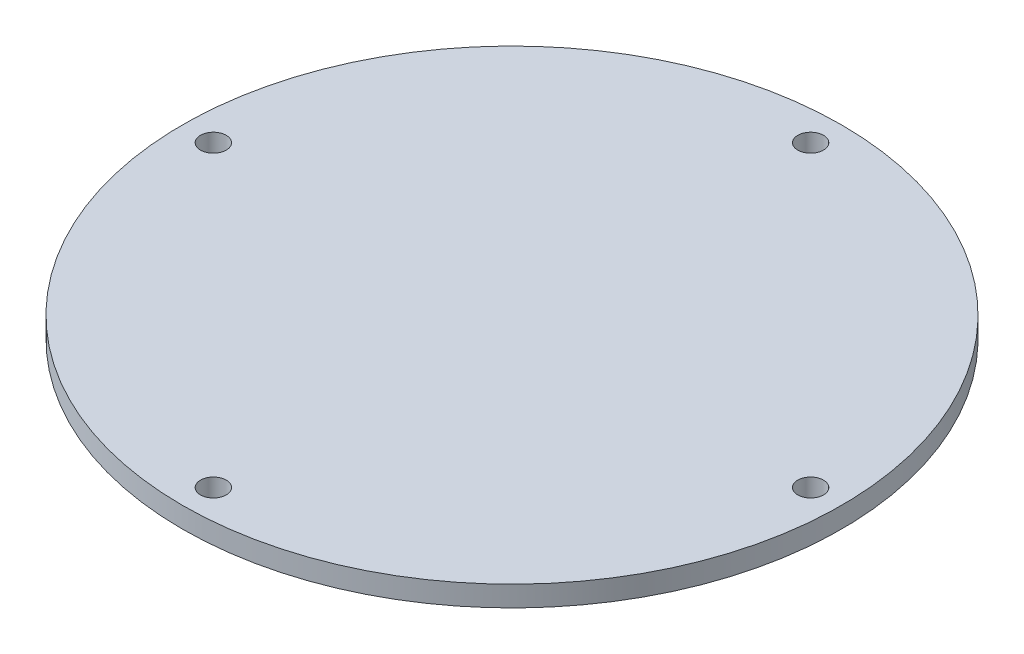
from build123d import *

# Parameters (mm, degrees)
SKETCH1_R           = 50.8
SKETCH1_R_2         = 1.984375
BOSS_EXTRUDE1_DEPTH = 3.175


with BuildPart() as part:
    # Sketch1 → Boss-Extrude1 (new body)
    with BuildSketch(Plane(origin=(0, 0, 0), x_dir=(1, 0, 0), z_dir=(0, 1, 0))):
        with Locations(Location((0, 0, 0), (0, 0, 270))):
            Circle(SKETCH1_R)
        with Locations(Location((0, 46.032792877, 0), (0, 0, 270))):
            Circle(SKETCH1_R_2, mode=Mode.SUBTRACT)
        with Locations(Location((46.032792877, 0, 0), (0, 0, 270))):
            Circle(SKETCH1_R_2, mode=Mode.SUBTRACT)
        with Locations(Location((0, -46.032792877, 0), (0, 0, 270))):
            Circle(SKETCH1_R_2, mode=Mode.SUBTRACT)
        with Locations(Location((-46.032792877, 0, 0), (0, 0, 270))):
            Circle(SKETCH1_R_2, mode=Mode.SUBTRACT)
    extrude(amount=BOSS_EXTRUDE1_DEPTH)


solid = part.part
